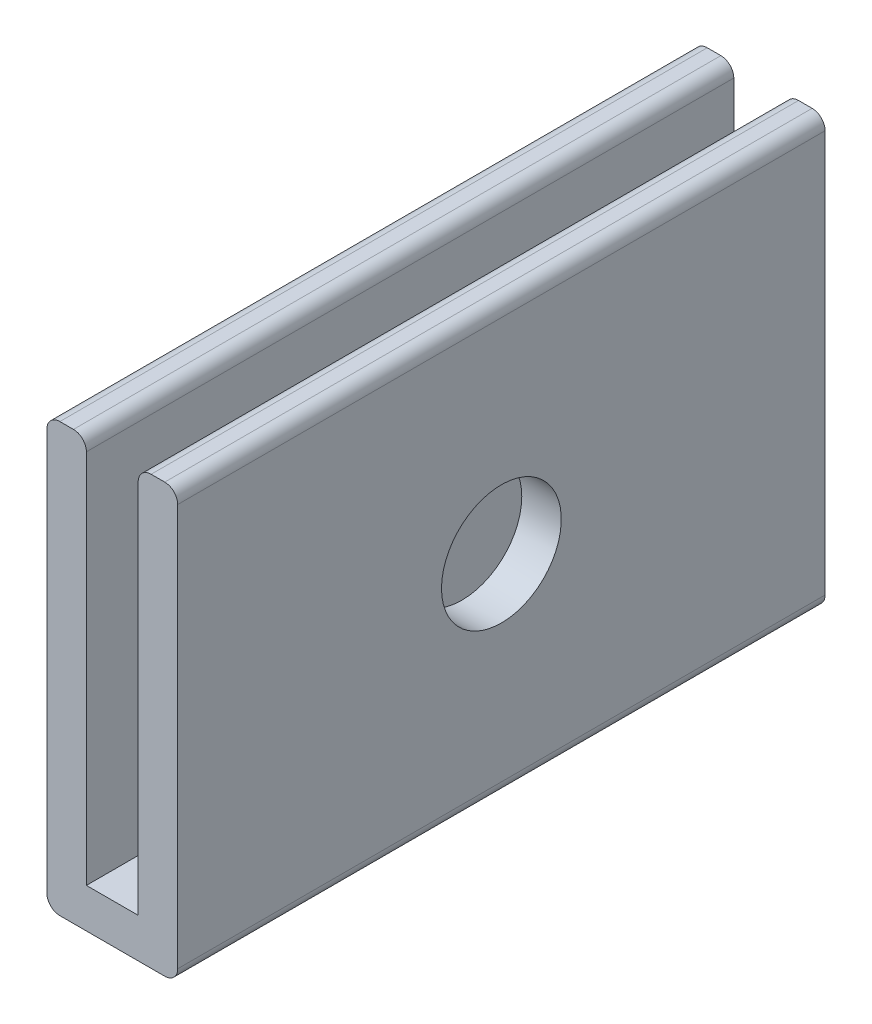
from build123d import *

# Parameters (mm, degrees)
BOSS_EXTRUDE1_DEPTH = 20
CUT_EXTRUDE1_REACH  = 26.312
SKETCH2_R           = 1.85


with BuildPart() as part:
    # Sketch1 → Boss-Extrude1 (new body)
    with BuildSketch(Plane.XY):
        with BuildLine():
            Line((3.22, 13.22), (3.64, 13.22))
            ThreePointArc((3.64, 13.22), (3.922842712, 13.102842712), (4.04, 12.82))
            Line((4.04, 12.82), (4.04, 0.4))
            ThreePointArc((4.04, 0.4), (3.922842712, 0.117157288), (3.64, 0))
            Line((3.64, 0), (0.4, 0))
            ThreePointArc((0.4, 0), (0.117157288, 0.117157288), (0, 0.4))
            Line((0, 0.4), (0, 12.82))
            ThreePointArc((0, 12.82), (0.117157288, 13.102842712), (0.4, 13.22))
            Line((0.4, 13.22), (0.82, 13.22))
            ThreePointArc((0.82, 13.22), (1.102842712, 13.102842712), (1.22, 12.82))
            Line((1.22, 12.82), (1.22, 1.22))
            Line((1.22, 1.22), (2.82, 1.22))
            Line((2.82, 1.22), (2.82, 12.82))
            ThreePointArc((2.82, 12.82), (2.937157288, 13.102842712), (3.22, 13.22))
        make_face()
    extrude(amount=BOSS_EXTRUDE1_DEPTH)

    # Cut-Extrude1: up to this face of the body (flat: up to its plane)
    cut_extrude1_end = Plane(part.part.faces().sort_by_distance((4.04, 6.61, 10))[0])
    # Sketch2 → Cut-Extrude1 (cut, up to the picked face)
    with BuildSketch(Plane.ZY, mode=Mode.PRIVATE) as cut_extrude1_sk1:
        with Locations((10, 6.5)):
            Circle(SKETCH2_R)
    cut_extrude1_tool1 = split(extrude(cut_extrude1_sk1.sketch, amount=-CUT_EXTRUDE1_REACH, mode=Mode.PRIVATE), bisect_by=cut_extrude1_end, keep=Keep.BOTH, mode=Mode.PRIVATE)
    add(cut_extrude1_tool1.solids().sort_by(Axis((0, 6.5, 10), (1, 0, 0)))[0], mode=Mode.SUBTRACT)


solid = part.part
